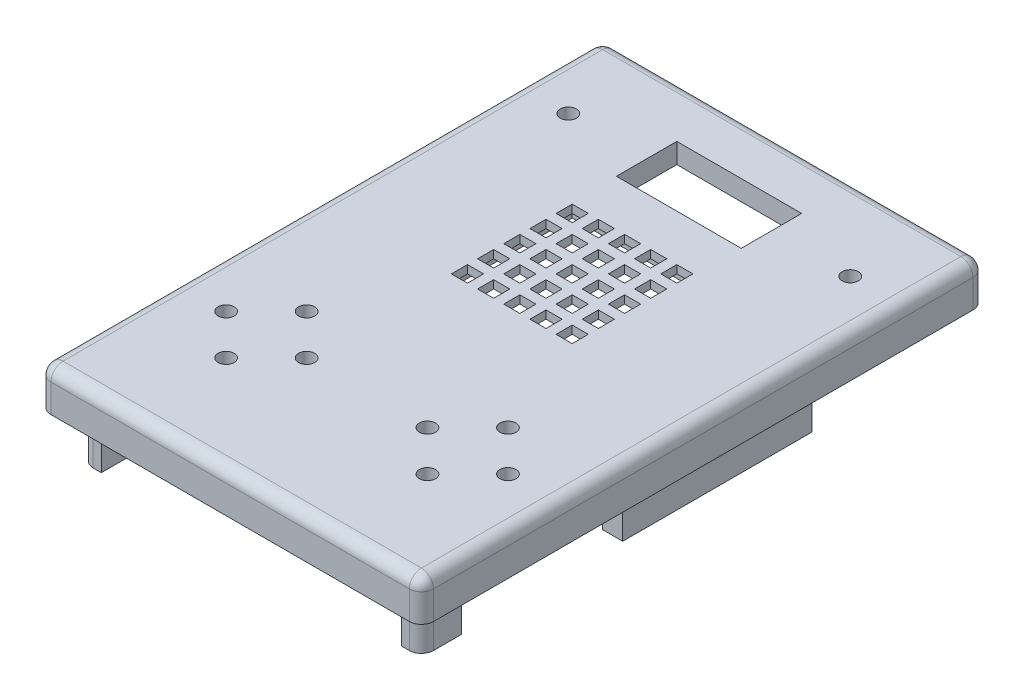
from build123d import *

# Parameters (mm, degrees)
SKETCH1_W           = 95
SKETCH1_H           = 140
BOSS_EXTRUDE1_DEPTH = 10
SKETCH7_W           = 5
SKETCH7_H           = 129
BOSS_EXTRUDE3_DEPTH = 11.5
SKETCH8_R           = 2
SKETCH8_W           = 31
SKETCH8_H           = 15
CUT_EXTRUDE1_DEPTH  = 10
SKETCH14_W          = 34
SKETCH14_H          = 34
CUT_EXTRUDE3_DEPTH  = 8
SKETCH13_W          = 4
SKETCH13_H          = 4
CUT_EXTRUDE4_DEPTH  = 7
SKETCH15_W          = 74.5
SKETCH15_H          = 129
CUT_EXTRUDE5_DEPTH  = 5
CUT_EXTRUDE8_REACH  = 89.284
SKETCH18_W          = 5
SKETCH18_H          = 32
SKETCH18_H_2        = 40
FILLET1_R           = 3


with BuildPart() as part:
    # Sketch1 → Boss-Extrude1 (new body)
    with BuildSketch(Plane(origin=(0, 0, 0), x_dir=(1, 0, 0), z_dir=(0, 1, 0))):
        Rectangle(SKETCH1_W, SKETCH1_H)
    extrude(amount=BOSS_EXTRUDE1_DEPTH)

    # Sketch7 → Boss-Extrude3 (add)
    with BuildSketch(Plane.XZ):
        with Locations((-39.75, 0.25)):
            Rectangle(SKETCH7_W, SKETCH7_H)
        with Locations((39.75, 0.25)):
            Rectangle(SKETCH7_W, SKETCH7_H)
    extrude(amount=BOSS_EXTRUDE3_DEPTH)

    # Sketch8 → Cut-Extrude1 (cut)
    with BuildSketch(Plane(origin=(0, 10, 0), x_dir=(1, 0, 0), z_dir=(0, 1, 0))):
        with Locations(Location((-35, 49, 0), (0, 0, 270))):
            Circle(SKETCH8_R)
        with Locations(Location((35, 49, 0), (0, 0, 270))):
            Circle(SKETCH8_R)
        with Locations(Location((-14.95, -36.05, 0), (0, 0, 270))):
            Circle(SKETCH8_R)
        with Locations(Location((-34.95, -36.05, 0), (0, 0, 270))):
            Circle(SKETCH8_R)
        with Locations(Location((-24.95, -46.05, 0), (0, 0, 270))):
            Circle(SKETCH8_R)
        with Locations(Location((-24.95, -26.05, 0), (0, 0, 270))):
            Circle(SKETCH8_R)
        with Locations(Location((25.05, -26.05, 0), (0, 0, 90))):
            Circle(SKETCH8_R)
        with Locations(Location((35.05, -36.05, 0), (0, 0, 90))):
            Circle(SKETCH8_R)
        with Locations(Location((25.05, -46.05, 0), (0, 0, 90))):
            Circle(SKETCH8_R)
        with Locations(Location((15.05, -36.05, 0), (0, 0, 90))):
            Circle(SKETCH8_R)
        with Locations((-0.05, 48.98)):
            Rectangle(SKETCH8_W, SKETCH8_H)
    extrude(amount=-CUT_EXTRUDE1_DEPTH, mode=Mode.SUBTRACT)

    # Sketch14 → Cut-Extrude3 (cut)
    with BuildSketch(Plane.XZ):
        with Locations((-0.045, -14.99)):
            Rectangle(SKETCH14_W, SKETCH14_H)
    extrude(amount=-CUT_EXTRUDE3_DEPTH, mode=Mode.SUBTRACT)

    # Sketch13 → Cut-Extrude4 (cut)
    with BuildSketch(Plane(origin=(0, 10, 0), x_dir=(1, 0, 0), z_dir=(0, 1, 0))):
        with Locations((-6.545, 27.99)):
            Rectangle(SKETCH13_W, SKETCH13_H)
        with Locations((-13.045, 27.99)):
            Rectangle(SKETCH13_W, SKETCH13_H)
        with Locations((-0.045, 27.99)):
            Rectangle(SKETCH13_W, SKETCH13_H)
        with Locations((6.455, 27.99)):
            Rectangle(SKETCH13_W, SKETCH13_H)
        with Locations((12.955, 27.99)):
            Rectangle(SKETCH13_W, SKETCH13_H)
        with Locations((-6.545, 21.49)):
            Rectangle(SKETCH13_W, SKETCH13_H)
        with Locations((-0.045, 21.49)):
            Rectangle(SKETCH13_W, SKETCH13_H)
        with Locations((6.455, 21.49)):
            Rectangle(SKETCH13_W, SKETCH13_H)
        with Locations((12.955, 21.49)):
            Rectangle(SKETCH13_W, SKETCH13_H)
        with Locations((-6.545, 14.99)):
            Rectangle(SKETCH13_W, SKETCH13_H)
        with Locations((-0.045, 14.99)):
            Rectangle(SKETCH13_W, SKETCH13_H)
        with Locations((6.455, 14.99)):
            Rectangle(SKETCH13_W, SKETCH13_H)
        with Locations((12.955, 14.99)):
            Rectangle(SKETCH13_W, SKETCH13_H)
        with Locations((-6.545, 8.49)):
            Rectangle(SKETCH13_W, SKETCH13_H)
        with Locations((-0.045, 8.49)):
            Rectangle(SKETCH13_W, SKETCH13_H)
        with Locations((6.455, 8.49)):
            Rectangle(SKETCH13_W, SKETCH13_H)
        with Locations((12.955, 8.49)):
            Rectangle(SKETCH13_W, SKETCH13_H)
        with Locations((-6.545, 1.99)):
            Rectangle(SKETCH13_W, SKETCH13_H)
        with Locations((-0.045, 1.99)):
            Rectangle(SKETCH13_W, SKETCH13_H)
        with Locations((6.455, 1.99)):
            Rectangle(SKETCH13_W, SKETCH13_H)
        with Locations((12.955, 1.99)):
            Rectangle(SKETCH13_W, SKETCH13_H)
        with Locations((-13.045, 21.49)):
            Rectangle(SKETCH13_W, SKETCH13_H)
        with Locations((-13.045, 14.99)):
            Rectangle(SKETCH13_W, SKETCH13_H)
        with Locations((-13.045, 8.49)):
            Rectangle(SKETCH13_W, SKETCH13_H)
        with Locations((-13.045, 1.99)):
            Rectangle(SKETCH13_W, SKETCH13_H)
    extrude(amount=-CUT_EXTRUDE4_DEPTH, mode=Mode.SUBTRACT)

    # Sketch15 → Cut-Extrude5 (cut)
    with BuildSketch(Plane.XZ):
        with Locations((0, 0.25)):
            Rectangle(SKETCH15_W, SKETCH15_H)
    extrude(amount=-CUT_EXTRUDE5_DEPTH, mode=Mode.SUBTRACT)

    # Cut-Extrude8: up to this face of the body (flat: up to its plane)
    cut_extrude8_end = Plane(part.part.faces().sort_by_distance((0.008932466, 5, 5.101088901))[0])
    # Sketch18 → Cut-Extrude8 (cut, up to the picked face)
    with BuildSketch(Plane.XZ.offset(11.5), mode=Mode.PRIVATE) as cut_extrude8_sk1:
        with Locations((-39.75, -48.25)):
            Rectangle(SKETCH18_W, SKETCH18_H)
    cut_extrude8_tool1 = split(extrude(cut_extrude8_sk1.sketch, amount=-CUT_EXTRUDE8_REACH, mode=Mode.PRIVATE), bisect_by=cut_extrude8_end, keep=Keep.BOTH, mode=Mode.PRIVATE)
    # Sketch18 → Cut-Extrude8 (cut, up to the picked face)
    with BuildSketch(Plane.XZ.offset(11.5), mode=Mode.PRIVATE) as cut_extrude8_sk2:
        with Locations((-39.75, 34.75)):
            Rectangle(SKETCH18_W, SKETCH18_H_2)
    cut_extrude8_tool2 = split(extrude(cut_extrude8_sk2.sketch, amount=-CUT_EXTRUDE8_REACH, mode=Mode.PRIVATE), bisect_by=cut_extrude8_end, keep=Keep.BOTH, mode=Mode.PRIVATE)
    # Sketch18 → Cut-Extrude8 (cut, up to the picked face)
    with BuildSketch(Plane.XZ.offset(11.5), mode=Mode.PRIVATE) as cut_extrude8_sk3:
        with Locations((39.75, -48.25)):
            Rectangle(SKETCH18_W, SKETCH18_H)
    cut_extrude8_tool3 = split(extrude(cut_extrude8_sk3.sketch, amount=-CUT_EXTRUDE8_REACH, mode=Mode.PRIVATE), bisect_by=cut_extrude8_end, keep=Keep.BOTH, mode=Mode.PRIVATE)
    # Sketch18 → Cut-Extrude8 (cut, up to the picked face)
    with BuildSketch(Plane.XZ.offset(11.5), mode=Mode.PRIVATE) as cut_extrude8_sk4:
        with Locations((39.75, 34.75)):
            Rectangle(SKETCH18_W, SKETCH18_H_2)
    cut_extrude8_tool4 = split(extrude(cut_extrude8_sk4.sketch, amount=-CUT_EXTRUDE8_REACH, mode=Mode.PRIVATE), bisect_by=cut_extrude8_end, keep=Keep.BOTH, mode=Mode.PRIVATE)
    add(cut_extrude8_tool1.solids().sort_by(Axis((-39.75, -11.5, -48.25), (0, 1, 0)))[0], mode=Mode.SUBTRACT)
    add(cut_extrude8_tool2.solids().sort_by(Axis((-39.75, -11.5, 34.75), (0, 1, 0)))[0], mode=Mode.SUBTRACT)
    add(cut_extrude8_tool3.solids().sort_by(Axis((39.75, -11.5, -48.25), (0, 1, 0)))[0], mode=Mode.SUBTRACT)
    add(cut_extrude8_tool4.solids().sort_by(Axis((39.75, -11.5, 34.75), (0, 1, 0)))[0], mode=Mode.SUBTRACT)

    # Fillet1
    fillet1_edges = [part.edges().sort_by_distance(p)[0] for p in [
        (0, 10, -70),
        (47.5, 10, 0),
        (-42.25, -5.75, 64.75),
        (42.25, -5.75, 64.75),
        (0, 10, 70),
        (42.25, 2.5, -64.25),
        (-42.25, 2.5, -64.25),
        (47.5, 5, 70),
        (47.5, 5, -70),
        (-47.5, 5, -70),
        (-47.5, 5, 70),
        (-47.5, 10, 0),
    ]]
    fillet(fillet1_edges, radius=FILLET1_R)


solid = part.part
